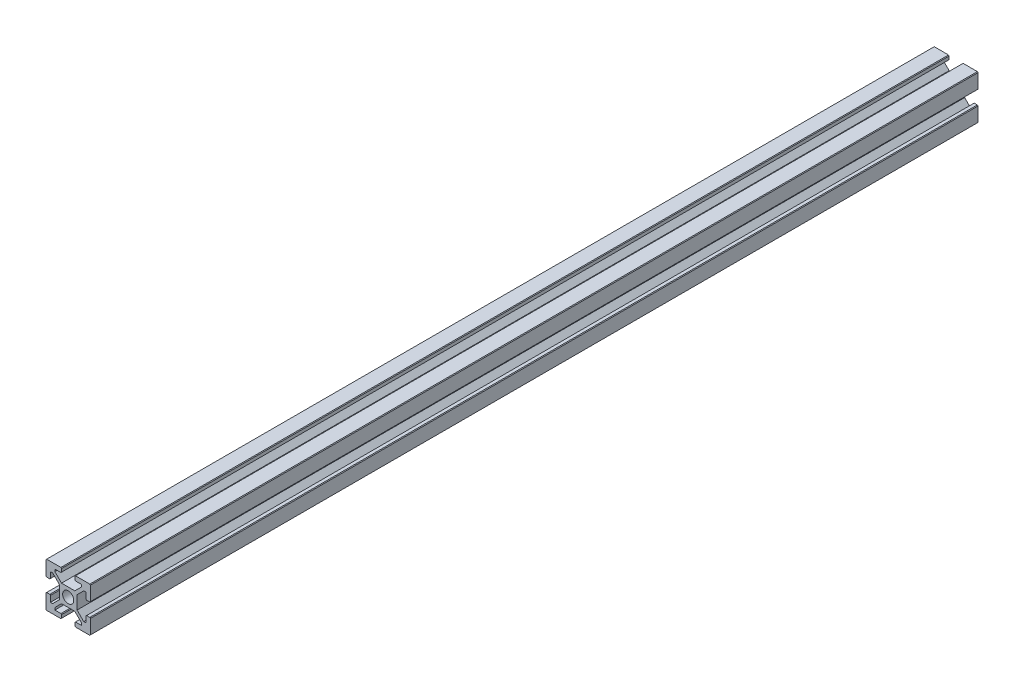
from build123d import *

# Parameters (mm, degrees)
SKETCH1_R           = 2.5
BOSS_EXTRUDE1_DEPTH = 400
CHAMFER1_SIZE       = 0.2828


with BuildPart() as part:
    # Sketch1 → Boss-Extrude1 (new body)
    with BuildSketch(Plane.XY):
        Polygon((-3, 8), (-3, 10), (-10, 10), (-10, 3), (-8, 3), (-8, 6), (-7, 6), (-4, 3), (-4, -3), (-7, -6), (-8, -6), (-8, -3), (-10, -3), (-10, -10), (-3, -10), (-3, -8), (-6, -8), (-6, -7), (-3, -4), (3, -4), (6, -7), (6, -8), (3, -8), (3, -10), (10, -10), (10, -3), (8, -3), (8, -6), (7, -6), (4, -3), (4, 3), (7, 6), (8, 6), (8, 3), (10, 3), (10, 10), (3, 10), (3, 8), (6, 8), (6, 7), (3, 4), (-3, 4), (-6, 7), (-6, 8), align=None)
        Circle(SKETCH1_R, mode=Mode.SUBTRACT)
    extrude(amount=BOSS_EXTRUDE1_DEPTH)

    # Chamfer1
    chamfer1_edges = [part.edges().sort_by_distance(p)[0] for p in [
        (-8, -3, 200),
        (-8, 3, 200),
        (-10, 3, 200),
        (-10, 10, 200),
        (-3, 10, 200),
        (-3, 8, 200),
        (3, 8, 200),
        (3, 10, 200),
        (10, 10, 200),
        (10, 3, 200),
        (8, 3, 200),
        (8, -3, 200),
        (10, -3, 200),
        (10, -10, 200),
        (3, -10, 200),
        (3, -8, 200),
        (-3, -8, 200),
        (-3, -10, 200),
        (-10, -10, 200),
        (-10, -3, 200),
    ]]
    chamfer(chamfer1_edges, length=CHAMFER1_SIZE)


solid = part.part
